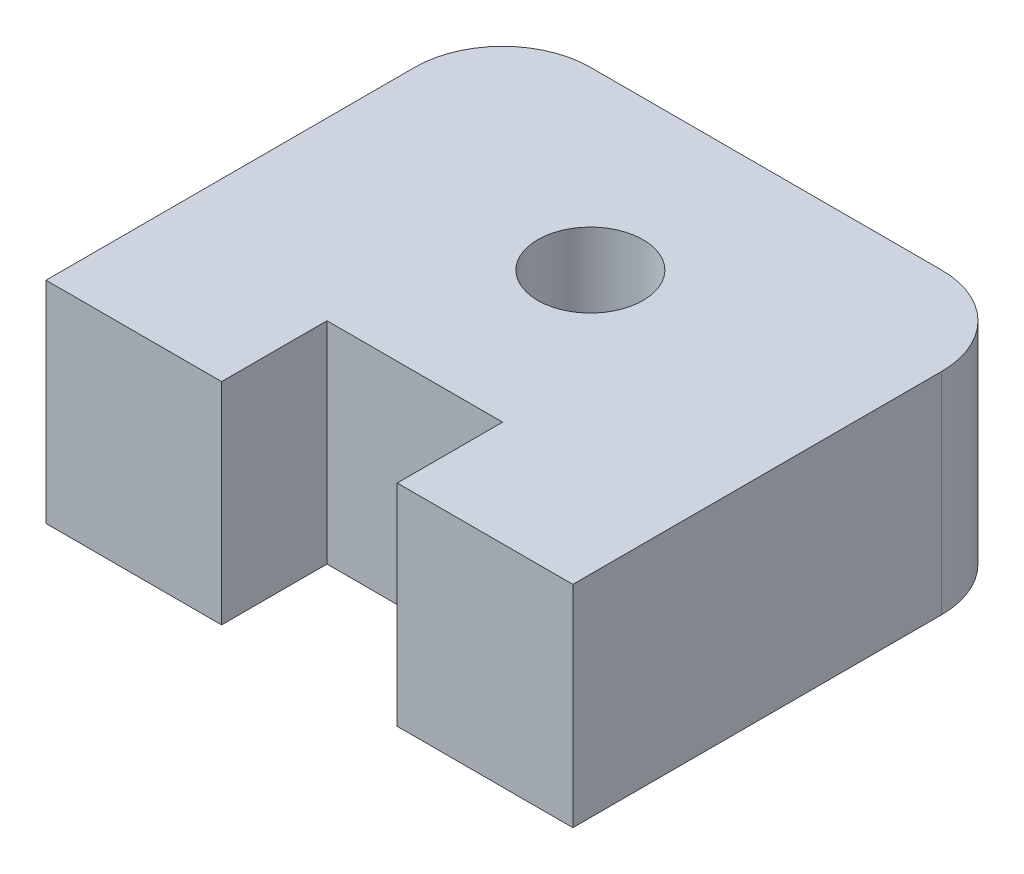
from build123d import *

# Parameters (mm, degrees)
SKETCH1_R           = 1.5
BOSS_EXTRUDE1_DEPTH = 6


with BuildPart() as part:
    # Sketch1 → Boss-Extrude1 (new body)
    with BuildSketch(Plane(origin=(0, 0, 0), x_dir=(1, 0, 0), z_dir=(0, 1, 0))):
        with BuildLine():
            Line((0, 0), (0, 10.5))
            ThreePointArc((0, 10.5), (0.732233047, 12.267766953), (2.5, 13))
            Line((2.5, 13), (12.5, 13))
            ThreePointArc((12.5, 13), (14.267766953, 12.267766953), (15, 10.5))
            Line((15, 10.5), (15, 0))
            Line((15, 0), (10, 0))
            Line((10, 0), (10, 3))
            Line((10, 3), (5, 3))
            Line((5, 3), (5, 0))
            Line((5, 0), (0, 0))
        make_face()
        with Locations(Location((7.5, 8, 0), (0, 0, 270))):
            Circle(SKETCH1_R, mode=Mode.SUBTRACT)
    extrude(amount=BOSS_EXTRUDE1_DEPTH)


solid = part.part
